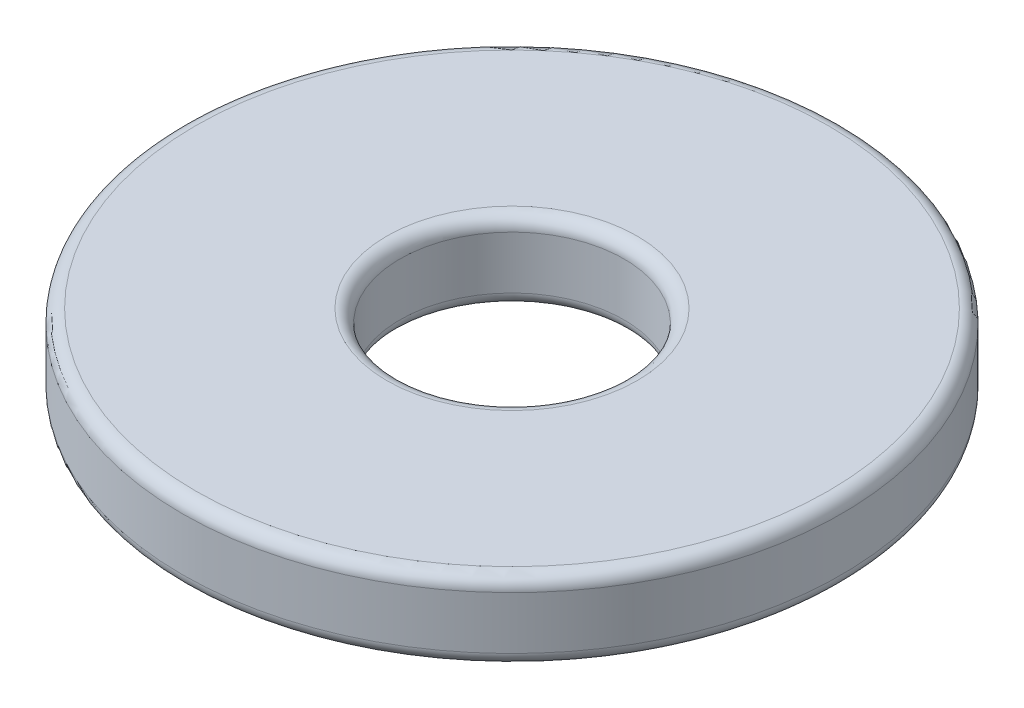
from build123d import *

# Parameters (mm, degrees)
CROQUIS1_R              = 12.5
CROQUIS1_R_2            = 4.25
SALIENTE_EXTRUIR1_DEPTH = 3
REDONDEO1_R             = 0.5


with BuildPart() as part:
    # Croquis1 → Saliente-Extruir1 (new body)
    with BuildSketch(Plane(origin=(0, 0, 0), x_dir=(1, 0, 0), z_dir=(0, 1, 0))):
        with Locations(Location((0, 0, 0), (0, 0, 270))):
            Circle(CROQUIS1_R)
        with Locations(Location((0, 0, 0), (0, 0, 270))):
            Circle(CROQUIS1_R_2, mode=Mode.SUBTRACT)
    extrude(amount=SALIENTE_EXTRUIR1_DEPTH)

    # Redondeo1
    redondeo1_edges = [part.edges().sort_by_distance(p)[0] for p in [
        (0, 0, -12.5),
        (0, 3, -12.5),
        (0, 0, -4.25),
        (0, 3, -4.25),
    ]]
    fillet(redondeo1_edges, radius=REDONDEO1_R)


solid = part.part
